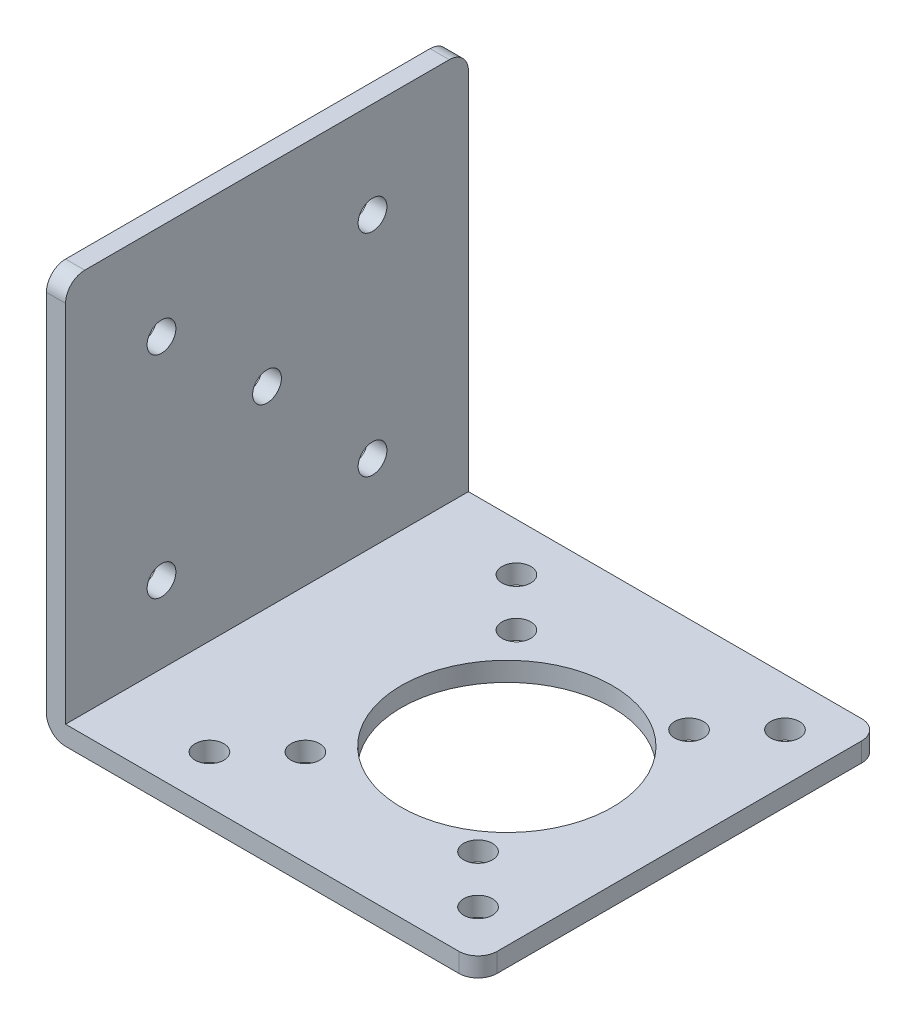
from build123d import *

# Parameters (mm, degrees)
BOSS_EXTRUDE1_DEPTH = 42
FILLET1_R           = 2
FILLET2_R           = 2
CUT_EXTRUDE1_REACH  = 75.41
SKETCH3_R           = 11
SKETCH3_R_2         = 1.5
CUT_EXTRUDE2_REACH  = 75.328
SKETCH4_R           = 1.5


with BuildPart() as part:
    # Sketch1 → Boss-Extrude1 (new body)
    with BuildSketch(Plane.XY):
        Polygon((0, 0), (45, 0), (45, 2), (2, 2), (2, 42), (0, 42), align=None)
    extrude(amount=-BOSS_EXTRUDE1_DEPTH)

    # Fillet1
    fillet1_edges = [part.edges().sort_by_distance(p)[0] for p in [
        (0, 0, -21),
    ]]
    fillet(fillet1_edges, radius=FILLET1_R)

    # Fillet2
    fillet2_edges = [part.edges().sort_by_distance(p)[0] for p in [
        (45, 1, -42),
        (1, 42, -42),
        (1, 42, 0),
        (45, 1, 0),
    ]]
    fillet(fillet2_edges, radius=FILLET2_R)

    # Sketch3 → Cut-Extrude1 (cut, up to next)
    with BuildSketch(Plane(origin=(0, 2, 0), x_dir=(1, 0, 0), z_dir=(0, 1, 0)), mode=Mode.PRIVATE) as cut_extrude1_sk1:
        with Locations(Location((27, 21, 0), (0, 0, 180))):
            Circle(SKETCH3_R)
    cut_extrude1_tool1 = extrude(cut_extrude1_sk1.sketch, amount=-CUT_EXTRUDE1_REACH, mode=Mode.PRIVATE) & part.part
    # Sketch3 → Cut-Extrude1 (cut, up to next)
    with BuildSketch(Plane(origin=(0, 2, 0), x_dir=(1, 0, 0), z_dir=(0, 1, 0)), mode=Mode.PRIVATE) as cut_extrude1_sk2:
        with Locations(Location((40, 37, 0), (0, 0, 180))):
            Circle(SKETCH3_R_2)
    cut_extrude1_tool2 = extrude(cut_extrude1_sk2.sketch, amount=-CUT_EXTRUDE1_REACH, mode=Mode.PRIVATE) & part.part
    # Sketch3 → Cut-Extrude1 (cut, up to next)
    with BuildSketch(Plane(origin=(0, 2, 0), x_dir=(1, 0, 0), z_dir=(0, 1, 0)), mode=Mode.PRIVATE) as cut_extrude1_sk3:
        with Locations(Location((40, 5, 0), (0, 0, 180))):
            Circle(SKETCH3_R_2)
    cut_extrude1_tool3 = extrude(cut_extrude1_sk3.sketch, amount=-CUT_EXTRUDE1_REACH, mode=Mode.PRIVATE) & part.part
    # Sketch3 → Cut-Extrude1 (cut, up to next)
    with BuildSketch(Plane(origin=(0, 2, 0), x_dir=(1, 0, 0), z_dir=(0, 1, 0)), mode=Mode.PRIVATE) as cut_extrude1_sk4:
        with Locations(Location((35, 32, 0), (0, 0, 180))):
            Circle(SKETCH3_R_2)
    cut_extrude1_tool4 = extrude(cut_extrude1_sk4.sketch, amount=-CUT_EXTRUDE1_REACH, mode=Mode.PRIVATE) & part.part
    # Sketch3 → Cut-Extrude1 (cut, up to next)
    with BuildSketch(Plane(origin=(0, 2, 0), x_dir=(1, 0, 0), z_dir=(0, 1, 0)), mode=Mode.PRIVATE) as cut_extrude1_sk5:
        with Locations(Location((35, 10, 0), (0, 0, 180))):
            Circle(SKETCH3_R_2)
    cut_extrude1_tool5 = extrude(cut_extrude1_sk5.sketch, amount=-CUT_EXTRUDE1_REACH, mode=Mode.PRIVATE) & part.part
    # Sketch3 → Cut-Extrude1 (cut, up to next)
    with BuildSketch(Plane(origin=(0, 2, 0), x_dir=(1, 0, 0), z_dir=(0, 1, 0)), mode=Mode.PRIVATE) as cut_extrude1_sk6:
        with Locations(Location((17, 10, 0), (0, 0, 180))):
            Circle(SKETCH3_R_2)
    cut_extrude1_tool6 = extrude(cut_extrude1_sk6.sketch, amount=-CUT_EXTRUDE1_REACH, mode=Mode.PRIVATE) & part.part
    # Sketch3 → Cut-Extrude1 (cut, up to next)
    with BuildSketch(Plane(origin=(0, 2, 0), x_dir=(1, 0, 0), z_dir=(0, 1, 0)), mode=Mode.PRIVATE) as cut_extrude1_sk7:
        with Locations(Location((17, 32, 0), (0, 0, 180))):
            Circle(SKETCH3_R_2)
    cut_extrude1_tool7 = extrude(cut_extrude1_sk7.sketch, amount=-CUT_EXTRUDE1_REACH, mode=Mode.PRIVATE) & part.part
    # Sketch3 → Cut-Extrude1 (cut, up to next)
    with BuildSketch(Plane(origin=(0, 2, 0), x_dir=(1, 0, 0), z_dir=(0, 1, 0)), mode=Mode.PRIVATE) as cut_extrude1_sk8:
        with Locations(Location((12, 37, 0), (0, 0, 180))):
            Circle(SKETCH3_R_2)
    cut_extrude1_tool8 = extrude(cut_extrude1_sk8.sketch, amount=-CUT_EXTRUDE1_REACH, mode=Mode.PRIVATE) & part.part
    # Sketch3 → Cut-Extrude1 (cut, up to next)
    with BuildSketch(Plane(origin=(0, 2, 0), x_dir=(1, 0, 0), z_dir=(0, 1, 0)), mode=Mode.PRIVATE) as cut_extrude1_sk9:
        with Locations(Location((12, 5, 0), (0, 0, 180))):
            Circle(SKETCH3_R_2)
    cut_extrude1_tool9 = extrude(cut_extrude1_sk9.sketch, amount=-CUT_EXTRUDE1_REACH, mode=Mode.PRIVATE) & part.part
    add(cut_extrude1_tool1.solids().sort_by_distance((27, 2, -21))[0], mode=Mode.SUBTRACT)
    add(cut_extrude1_tool2.solids().sort_by_distance((40, 2, -37))[0], mode=Mode.SUBTRACT)
    add(cut_extrude1_tool3.solids().sort_by_distance((40, 2, -5))[0], mode=Mode.SUBTRACT)
    add(cut_extrude1_tool4.solids().sort_by_distance((35, 2, -32))[0], mode=Mode.SUBTRACT)
    add(cut_extrude1_tool5.solids().sort_by_distance((35, 2, -10))[0], mode=Mode.SUBTRACT)
    add(cut_extrude1_tool6.solids().sort_by_distance((17, 2, -10))[0], mode=Mode.SUBTRACT)
    add(cut_extrude1_tool7.solids().sort_by_distance((17, 2, -32))[0], mode=Mode.SUBTRACT)
    add(cut_extrude1_tool8.solids().sort_by_distance((12, 2, -37))[0], mode=Mode.SUBTRACT)
    add(cut_extrude1_tool9.solids().sort_by_distance((12, 2, -5))[0], mode=Mode.SUBTRACT)

    # Sketch4 → Cut-Extrude2 (cut, up to next)
    with BuildSketch(Plane(origin=(2, 0, 0), x_dir=(0, 0, -1), z_dir=(1, 0, 0)), mode=Mode.PRIVATE) as cut_extrude2_sk1:
        with Locations(Location((21, 22, 0), (0, 0, 90))):
            Circle(SKETCH4_R)
    cut_extrude2_tool1 = extrude(cut_extrude2_sk1.sketch, amount=-CUT_EXTRUDE2_REACH, mode=Mode.PRIVATE) & part.part
    # Sketch4 → Cut-Extrude2 (cut, up to next)
    with BuildSketch(Plane(origin=(2, 0, 0), x_dir=(0, 0, -1), z_dir=(1, 0, 0)), mode=Mode.PRIVATE) as cut_extrude2_sk2:
        with Locations(Location((10, 32, 0), (0, 0, 90))):
            Circle(SKETCH4_R)
    cut_extrude2_tool2 = extrude(cut_extrude2_sk2.sketch, amount=-CUT_EXTRUDE2_REACH, mode=Mode.PRIVATE) & part.part
    # Sketch4 → Cut-Extrude2 (cut, up to next)
    with BuildSketch(Plane(origin=(2, 0, 0), x_dir=(0, 0, -1), z_dir=(1, 0, 0)), mode=Mode.PRIVATE) as cut_extrude2_sk3:
        with Locations(Location((32, 32, 0), (0, 0, 90))):
            Circle(SKETCH4_R)
    cut_extrude2_tool3 = extrude(cut_extrude2_sk3.sketch, amount=-CUT_EXTRUDE2_REACH, mode=Mode.PRIVATE) & part.part
    # Sketch4 → Cut-Extrude2 (cut, up to next)
    with BuildSketch(Plane(origin=(2, 0, 0), x_dir=(0, 0, -1), z_dir=(1, 0, 0)), mode=Mode.PRIVATE) as cut_extrude2_sk4:
        with Locations(Location((10, 10, 0), (0, 0, 90))):
            Circle(SKETCH4_R)
    cut_extrude2_tool4 = extrude(cut_extrude2_sk4.sketch, amount=-CUT_EXTRUDE2_REACH, mode=Mode.PRIVATE) & part.part
    # Sketch4 → Cut-Extrude2 (cut, up to next)
    with BuildSketch(Plane(origin=(2, 0, 0), x_dir=(0, 0, -1), z_dir=(1, 0, 0)), mode=Mode.PRIVATE) as cut_extrude2_sk5:
        with Locations(Location((32, 10, 0), (0, 0, 90))):
            Circle(SKETCH4_R)
    cut_extrude2_tool5 = extrude(cut_extrude2_sk5.sketch, amount=-CUT_EXTRUDE2_REACH, mode=Mode.PRIVATE) & part.part
    add(cut_extrude2_tool1.solids().sort_by_distance((2, 22, -21))[0], mode=Mode.SUBTRACT)
    add(cut_extrude2_tool2.solids().sort_by_distance((2, 32, -10))[0], mode=Mode.SUBTRACT)
    add(cut_extrude2_tool3.solids().sort_by_distance((2, 32, -32))[0], mode=Mode.SUBTRACT)
    add(cut_extrude2_tool4.solids().sort_by_distance((2, 10, -10))[0], mode=Mode.SUBTRACT)
    add(cut_extrude2_tool5.solids().sort_by_distance((2, 10, -32))[0], mode=Mode.SUBTRACT)


solid = part.part
